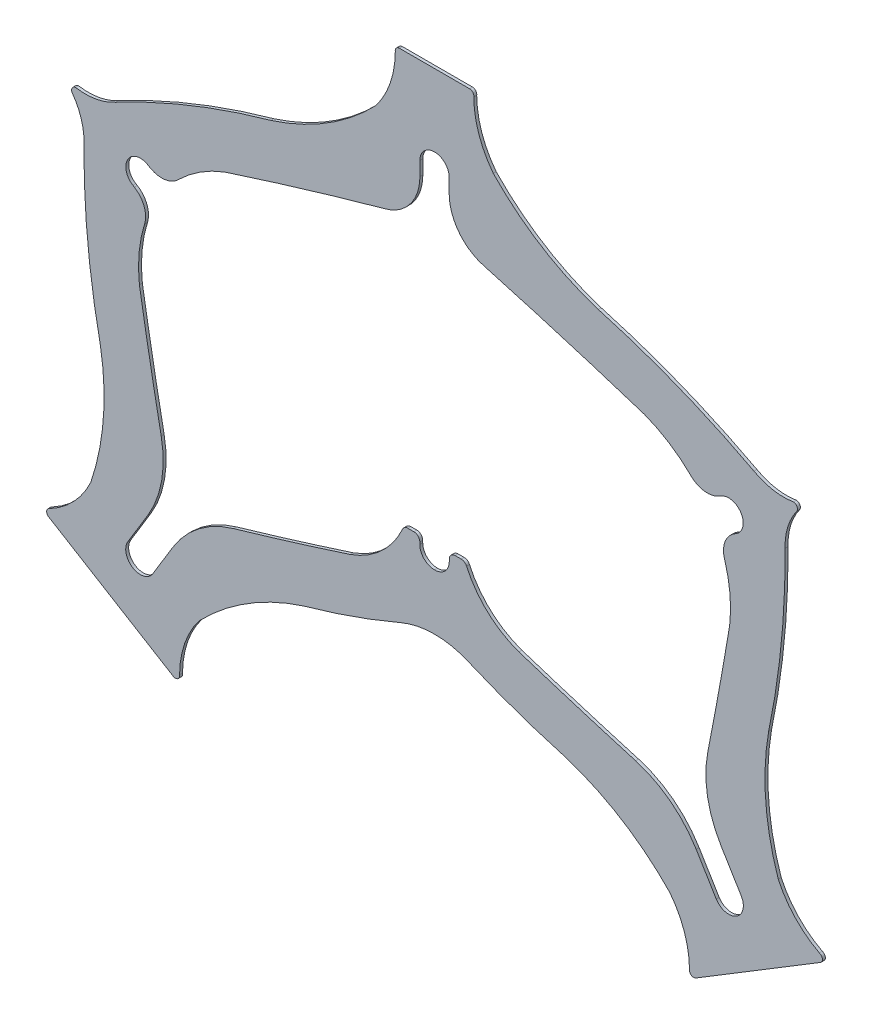
from build123d import *

# Parameters (mm, degrees)
BOSS_EXTRUDE1_DEPTH = 6.35


with BuildPart() as part:
    # Model → Boss-Extrude1 (new body)
    with BuildSketch(Plane.XY):
        with BuildLine():
            Line((4.35423024, 165.635434247), (139.469217612, 83.486362243))
            Line((139.469217612, 83.486362243), (274.584204983, 1.33729024))
            ThreePointArc((274.584204983, 1.33729024), (284.613951479, 1.632058994), (288.42972151, 10.912285417))
            ThreePointArc((288.42972151, 10.912285417), (299.56530956, 75.734935389), (330.90150065, 133.562440942))
            ThreePointArc((330.90150065, 133.562440942), (348.371163031, 150.942054961), (366.610982668, 167.511577185))
            ThreePointArc((366.610982668, 167.511577185), (457.042015558, 231.099527282), (558.47317207, 275.064508752))
            ThreePointArc((558.47317207, 275.064508752), (664.902483594, 308.599892952), (768.896422643, 349.060750407))
            ThreePointArc((768.896422643, 349.060750407), (804.531090958, 360.181940267), (841.675709373, 363.895129261))
            ThreePointArc((841.675709373, 363.895129261), (878.82032779, 360.181940267), (914.454996104, 349.060750407))
            ThreePointArc((914.454996104, 349.060750407), (1018.448935155, 308.599892952), (1124.878246681, 275.064508752))
            ThreePointArc((1124.878246681, 275.064508752), (1226.309403191, 231.099527281), (1316.740436079, 167.511577185))
            ThreePointArc((1316.740436079, 167.511577185), (1334.980255717, 150.942054961), (1352.449918097, 133.562440942))
            ThreePointArc((1352.449918097, 133.562440942), (1383.786109187, 75.734935389), (1394.921697237, 10.912285417))
            ThreePointArc((1394.921697237, 10.912285417), (1398.737467268, 1.632058994), (1408.767213764, 1.33729024))
            Line((1408.767213764, 1.33729024), (1543.882201136, 83.486362243))
            Line((1543.882201136, 83.486362243), (1678.997188507, 165.635434247))
            ThreePointArc((1678.997188507, 165.635434247), (1683.351383353, 174.675549878), (1676.868448231, 182.334156514))
            ThreePointArc((1676.868448231, 182.334156514), (1624.443410929, 222.053078132), (1587.525422045, 276.486885341))
            ThreePointArc((1587.525422045, 276.486885341), (1560.34752833, 408.759091988), (1566.632287475, 543.648218164))
            ThreePointArc((1566.632287475, 543.648218164), (1594.247944771, 723.73196509), (1602.388911699, 905.738847083))
            ThreePointArc((1602.388911699, 905.738847083), (1608.393141444, 949.493417753), (1628.435079487, 988.848645472))
            ThreePointArc((1628.435079487, 988.848645472), (1629.232553539, 993.201988834), (1627.90862234, 997.425112023))
            ThreePointArc((1627.90862234, 997.425112023), (1624.76861318, 1000.544071106), (1620.536680372, 1001.839566375))
            ThreePointArc((1620.536680372, 1001.839566375), (1576.373215463, 1002.15830841), (1534.76442971, 1016.964461776))
            ThreePointArc((1534.76442971, 1016.964461776), (1369.431208537, 1093.500116289), (1196.84270997, 1151.860981578))
            ThreePointArc((1196.84270997, 1151.860981578), (1095.411553456, 1195.825963048), (1004.980520565, 1259.413913146))
            ThreePointArc((1004.980520565, 1259.413913146), (986.740700928, 1275.98343537), (969.271038547, 1293.363049389))
            ThreePointArc((969.271038547, 1293.363049389), (937.934847458, 1351.190554942), (926.799259407, 1416.013204913))
            ThreePointArc((926.799259407, 1416.013204913), (924.83388788, 1423.598388709), (917.741514416, 1426.92944516))
            Line((917.741514416, 1426.92944516), (841.675709374, 1426.92944516))
            Line((841.675709374, 1426.92944516), (765.609904332, 1426.92944516))
            ThreePointArc((765.609904332, 1426.92944516), (758.517530867, 1423.598388709), (756.55215934, 1416.013204913))
            ThreePointArc((756.55215934, 1416.013204913), (745.41657129, 1351.190554942), (714.0803802, 1293.363049389))
            ThreePointArc((714.0803802, 1293.363049389), (696.610717819, 1275.98343537), (678.370898182, 1259.413913146))
            ThreePointArc((678.370898182, 1259.413913146), (587.939865291, 1195.825963048), (486.508708777, 1151.860981578))
            ThreePointArc((486.508708777, 1151.860981578), (313.920210211, 1093.500116289), (148.58698904, 1016.964461777))
            ThreePointArc((148.58698904, 1016.964461777), (106.978203286, 1002.158308411), (62.814738375, 1001.839566375))
            ThreePointArc((62.814738375, 1001.839566375), (58.582805567, 1000.544071106), (55.442796407, 997.425112023))
            ThreePointArc((55.442796407, 997.425112023), (54.118865208, 993.201988834), (54.91633926, 988.848645472))
            ThreePointArc((54.91633926, 988.848645472), (74.958277304, 949.493417753), (80.962507049, 905.738847083))
            ThreePointArc((80.962507049, 905.738847083), (89.103473976, 723.73196509), (116.719131272, 543.648218164))
            ThreePointArc((116.719131272, 543.648218164), (123.003890417, 408.759091988), (95.825996702, 276.486885341))
            ThreePointArc((95.825996702, 276.486885341), (58.908007818, 222.053078132), (6.482970516, 182.334156514))
            ThreePointArc((6.482970516, 182.334156514), (3.5394e-05, 174.675549878), (4.35423024, 165.635434247))
        make_face()
        with BuildLine():
            ThreePointArc((230.435428938, 171.988006214), (186.811751564, 161.353168539), (176.176913889, 204.976845914))
            Line((176.176913889, 204.976845914), (219.666503461, 276.506507813))
            ThreePointArc((219.666503461, 276.506507813), (249.41858659, 355.319849433), (248.604010602, 439.557998355))
            ThreePointArc((248.604010602, 439.557998355), (223.92684494, 569.757162888), (201.250512588, 700.319672443))
            ThreePointArc((201.250512588, 700.319672443), (200.544706813, 760.636081732), (212.373594943, 819.785424898))
            ThreePointArc((212.373594943, 819.785424898), (211.391671526, 852.848321029), (190.262486725, 878.297816581))
            Line((190.262486725, 878.297816581), (187.019990651, 880.269234028))
            ThreePointArc((187.019990651, 880.269234028), (176.385152977, 923.892911403), (220.008830352, 934.527749077))
            Line((220.008830352, 934.527749077), (223.251326425, 932.55633163))
            ThreePointArc((223.251326425, 932.55633163), (255.569588474, 925.510111894), (285.374887402, 939.854568323))
            ThreePointArc((285.374887402, 939.854568323), (332.444064978, 977.578034675), (386.318088828, 1004.710247))
            ThreePointArc((386.318088828, 1004.710247), (560.399041188, 1059.206662677), (735.592244912, 1110.013932483))
            ThreePointArc((735.592244912, 1110.013932483), (789.235659351, 1146.436483903), (809.925709373, 1207.886788985))
            Line((809.925709373, 1207.886788985), (809.925709373, 1238.443064765))
            ThreePointArc((809.925709373, 1238.443064765), (819.225069071, 1260.893705067), (841.675709374, 1270.193064765))
            ThreePointArc((841.675709374, 1270.193064765), (864.126349676, 1260.893705067), (873.425709374, 1238.443064765))
            Line((873.425709374, 1238.443064765), (873.425709374, 1207.886788985))
            ThreePointArc((873.425709374, 1207.886788985), (894.115759397, 1146.436483903), (947.759173836, 1110.013932483))
            ThreePointArc((947.759173836, 1110.013932483), (1122.952377559, 1059.206662677), (1297.03332992, 1004.710247))
            ThreePointArc((1297.03332992, 1004.710247), (1350.907353769, 977.578034675), (1397.976531346, 939.854568323))
            ThreePointArc((1397.976531346, 939.854568323), (1427.781830274, 925.510111903), (1460.100092322, 932.55633163))
            Line((1460.100092322, 932.55633163), (1463.342588395, 934.527749077))
            ThreePointArc((1463.342588395, 934.527749077), (1506.96626577, 923.892911403), (1496.331428096, 880.269234028))
            Line((1496.331428096, 880.269234028), (1493.088932022, 878.297816581))
            ThreePointArc((1493.088932022, 878.297816581), (1471.959747212, 852.848321033), (1470.977823804, 819.785424898))
            ThreePointArc((1470.977823804, 819.785424898), (1482.806711935, 760.636081732), (1482.100906159, 700.319672443))
            ThreePointArc((1482.100906159, 700.319672443), (1459.424573808, 569.757162888), (1434.747408146, 439.557998355))
            ThreePointArc((1434.747408146, 439.557998355), (1433.932832157, 355.319849433), (1463.684915286, 276.506507814))
            Line((1463.684915286, 276.506507814), (1507.174504858, 204.976845914))
            ThreePointArc((1507.174504858, 204.976845914), (1496.539667184, 161.353168539), (1452.915989809, 171.988006214))
            Line((1452.915989809, 171.988006214), (1409.426400237, 243.517668114))
            ThreePointArc((1409.426400237, 243.517668114), (1353.148046842, 306.20320239), (1277.986129436, 344.248115849))
            ThreePointArc((1277.986129436, 344.248115849), (1151.037755853, 382.25989552), (1024.687626725, 422.215243331))
            ThreePointArc((1024.687626725, 422.215243331), (957.191769225, 462.706773525), (911.118304628, 526.522842482))
            ThreePointArc((911.118304628, 526.522842482), (906.432646334, 531.976812224), (899.536415282, 534.012291743))
            Line((899.536415282, 534.012291743), (886.352318699, 534.012291743))
            ThreePointArc((886.352318699, 534.012291743), (877.372062578, 530.292547864), (873.652318699, 521.312291743))
            Line((873.652318699, 521.312291743), (873.652318699, 516.47003269))
            ThreePointArc((873.652318699, 516.47003269), (864.272697037, 493.939416342), (841.675709374, 484.72084139))
            ThreePointArc((841.675709374, 484.72084139), (819.078721711, 493.939416342), (809.699100048, 516.47003269))
            Line((809.699100048, 516.47003269), (809.699100048, 521.312291743))
            ThreePointArc((809.699100048, 521.312291743), (805.979356169, 530.292547864), (796.999100048, 534.012291743))
            Line((796.999100048, 534.012291743), (783.815003465, 534.012291743))
            ThreePointArc((783.815003465, 534.012291743), (776.918772409, 531.97681223), (772.23311412, 526.522842482))
            ThreePointArc((772.23311412, 526.522842482), (726.159649523, 462.706773525), (658.663792022, 422.215243331))
            ThreePointArc((658.663792022, 422.215243331), (532.313662894, 382.25989552), (405.365289309, 344.248115848))
            ThreePointArc((405.365289309, 344.248115848), (330.203371904, 306.203202389), (273.92501851, 243.517668114))
            Line((273.92501851, 243.517668114), (230.435428938, 171.988006214))
        make_face(mode=Mode.SUBTRACT)
    extrude(amount=BOSS_EXTRUDE1_DEPTH)


solid = part.part
